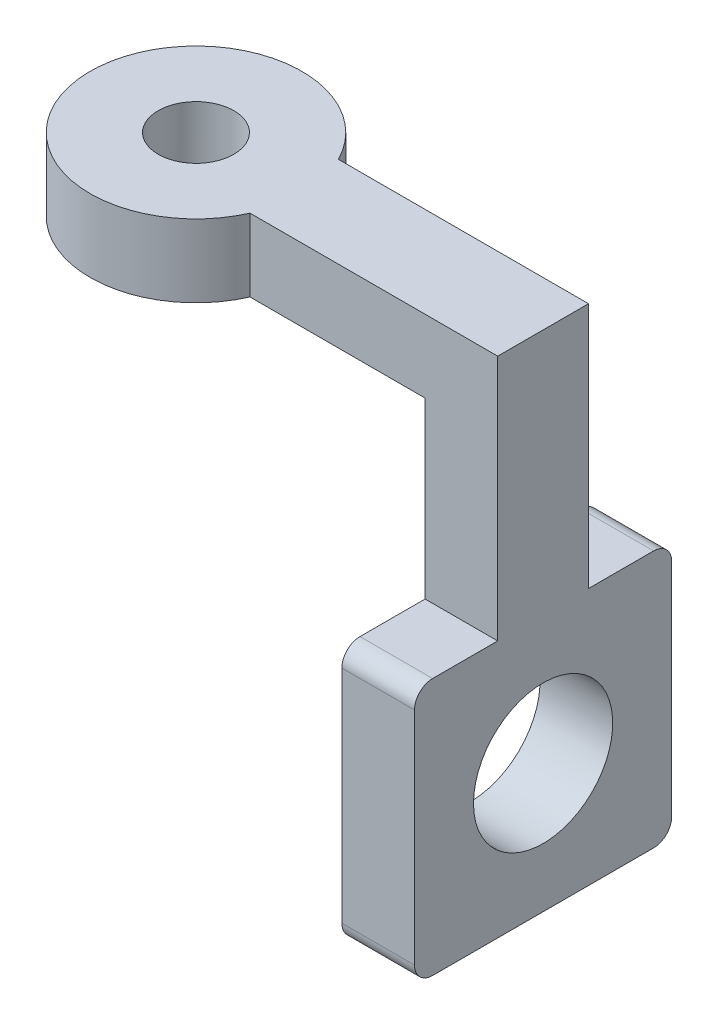
from build123d import *

# Parameters (mm, degrees)
Y_KSEKLIK_EKSTR_ZYON1_DEPTH = 12
IZIM2_W                     = 12
IZIM2_H                     = 15
Y_KSEKLIK_EKSTR_ZYON2_DEPTH = 71.25
IZIM3_W                     = 12
IZIM3_H                     = 42.5
Y_KSEKLIK_EKSTR_ZYON3_DEPTH = 13.75
IZIM4_W                     = 12
IZIM4_H                     = 42.5
Y_KSEKLIK_EKSTR_ZYON4_DEPTH = 13.75
F_23_0_23_AP_DELIK1_D       = 23
F_12_5_12_5_AP_DELIK1_D     = 12.5
F_12_5_12_5_AP_DELIK1_DEPTH = 83.25
RADYUS1_R                   = 3


with BuildPart() as part:
    # Çizim1 → Yükseklik-Ekstrüzyon1 (new body)
    with BuildSketch(Plane.XZ.offset(-37.9375)):
        with BuildLine():
            Line((-1.153440428, 15), (-42.076338309, 15))
            ThreePointArc((-42.076338309, 15), (-75.574161168, 8.385590262), (-42.47527254, 0))
            Line((-42.47527254, 0), (-1.153440428, 0))
            Line((-1.153440428, 0), (-1.153440428, 15))
        make_face()
    extrude(amount=-Y_KSEKLIK_EKSTR_ZYON1_DEPTH)

    # Çizim2 → Yükseklik-Ekstrüzyon2 (add)
    with BuildSketch(Plane.XZ.offset(-37.9375)):
        with Locations((-7.153440428, 7.5)):
            Rectangle(IZIM2_W, IZIM2_H)
    extrude(amount=Y_KSEKLIK_EKSTR_ZYON2_DEPTH)

    # Çizim3 → Yükseklik-Ekstrüzyon3 (add)
    with BuildSketch(Plane(origin=(0, 0, 0), x_dir=(-1, 0, 0), z_dir=(0, 0, -1))):
        with Locations((7.153440428, -12.0625)):
            Rectangle(IZIM3_W, IZIM3_H)
    extrude(amount=Y_KSEKLIK_EKSTR_ZYON3_DEPTH)

    # Çizim4 → Yükseklik-Ekstrüzyon4 (add)
    with BuildSketch(Plane.XY.offset(15)):
        with Locations((-7.153440428, -12.0625)):
            Rectangle(IZIM4_W, IZIM4_H)
    extrude(amount=Y_KSEKLIK_EKSTR_ZYON4_DEPTH)

    # Ø23.0 (23) Çap Delik1 (through all)
    with Locations(Plane.ZY.offset(13.153440428)):
        with Locations((7.5, -12.0625)):
            Hole(F_23_0_23_AP_DELIK1_D / 2)

    # Ø12.5 (12.5) Çap Delik1
    with Locations(Plane(origin=(0, 49.9375, 0), x_dir=(1, 0, 0), z_dir=(0, 1, 0))):
        with Locations((-58.080346996, -7.920331509)):
            Hole(F_12_5_12_5_AP_DELIK1_D / 2, depth=F_12_5_12_5_AP_DELIK1_DEPTH)

    # Radyus1
    radyus1_edges = [part.edges().sort_by_distance(p)[0] for p in [
        (-7.153440428, -33.3125, -13.75),
        (-7.153440428, 9.1875, -13.75),
        (-7.153440428, -33.3125, 28.75),
        (-7.153440428, 9.1875, 28.75),
    ]]
    fillet(radyus1_edges, radius=RADYUS1_R)


solid = part.part
